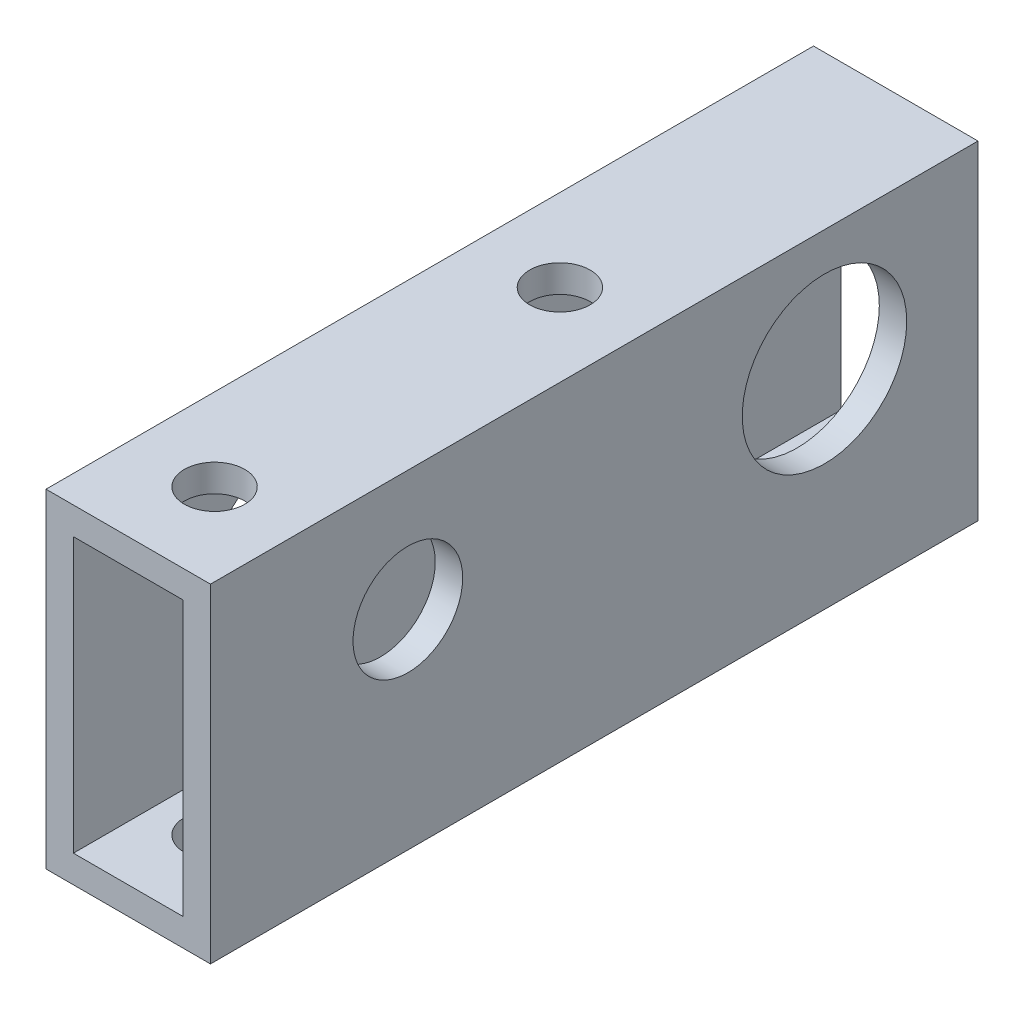
from build123d import *

# Parameters (mm, degrees)
SKETCH1_W           = 19.05
SKETCH1_H           = 38.1
SKETCH1_W_2         = 12.7
SKETCH1_H_2         = 31.75
BOSS_EXTRUDE1_DEPTH = 44.45
SKETCH2_R           = 3.5
CUT_EXTRUDE1_DEPTH  = 76.2
SKETCH3_R           = 6.35
SKETCH3_R_2         = 9.525
CUT_EXTRUDE2_DEPTH  = 52.976990101


with BuildPart() as part:
    # Sketch1 → Boss-Extrude1 (new, symmetric)
    with BuildSketch(Plane.XY):
        Rectangle(SKETCH1_W, SKETCH1_H)
        Rectangle(SKETCH1_W_2, SKETCH1_H_2, mode=Mode.SUBTRACT)
    extrude(amount=BOSS_EXTRUDE1_DEPTH, both=True)

    # Sketch2 → Cut-Extrude1 (cut)
    with BuildSketch(Plane.XZ.offset(19.05)):
        with Locations(Location((0, 34.45, 0), (0, 0, 270))):
            Circle(SKETCH2_R)
        with Locations(Location((0, -5.55, 0), (0, 0, 270))):
            Circle(SKETCH2_R)
    extrude(amount=-CUT_EXTRUDE1_DEPTH, mode=Mode.SUBTRACT)

    # Sketch3 → Cut-Extrude2 (cut, through all)
    with BuildSketch(Plane(origin=(9.525, 0, 0), x_dir=(0, 0, -1), z_dir=(1, 0, 0))):
        with Locations((-21.59, 5.08)):
            Circle(SKETCH3_R)
        with Locations((26.67, 5.08)):
            Circle(SKETCH3_R_2)
    extrude(amount=-CUT_EXTRUDE2_DEPTH, mode=Mode.SUBTRACT)


solid = part.part
